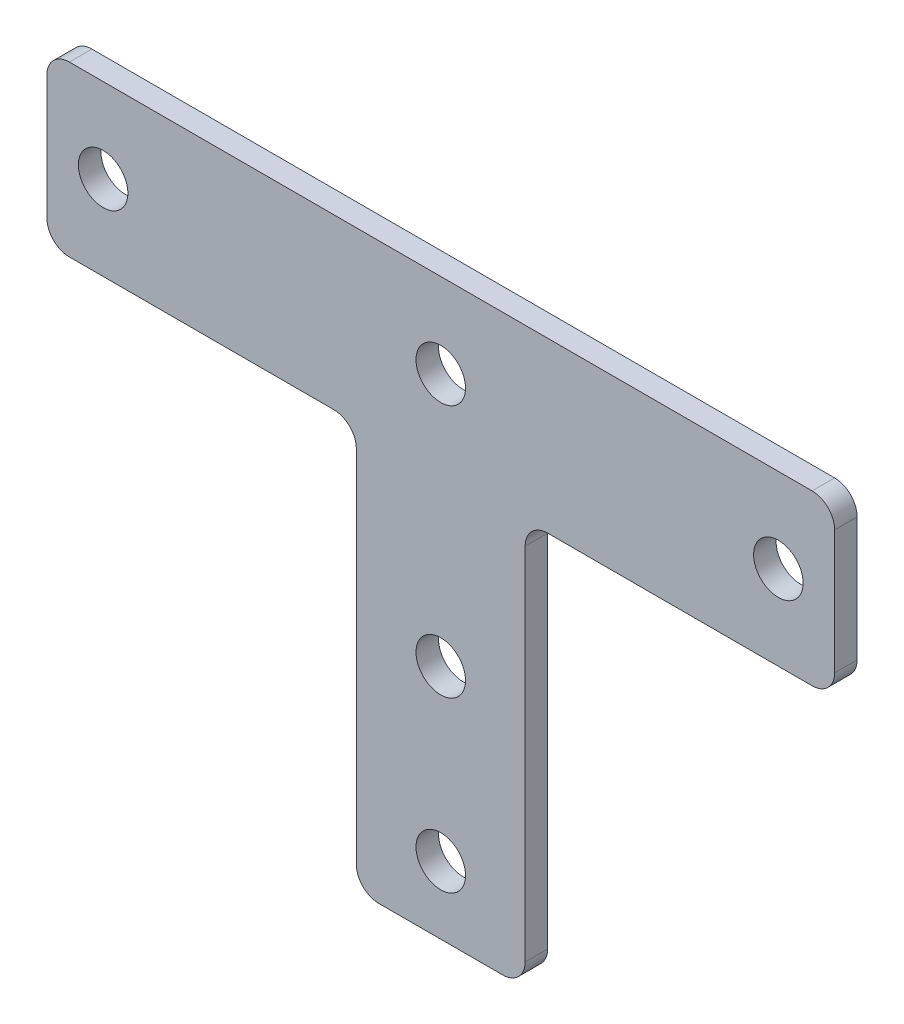
from build123d import *

# Parameters (mm, degrees)
SKETCH_1_W      = 27.5
SKETCH_1_H      = 15
SKETCH_1_R      = 2.2
SKETCH_1_W_2    = 15
SKETCH_1_H_2    = 36
EXTRUDE_1_DEPTH = 2
FILLET_1_R      = 2


with BuildPart() as part:
    # 草图1 → 凸台-拉伸1 (new body)
    # profile 1 of 4: a face of its own
    with BuildSketch(Plane.XY):
        with Locations((13.75, -7.5)):
            Rectangle(SKETCH_1_W, SKETCH_1_H)
        with Locations((5, -7.5)):
            Circle(SKETCH_1_R, mode=Mode.SUBTRACT)
    # profile 2 of 4: a face of its own
    with BuildSketch(Plane.XY):
        with Locations((56.25, -7.5)):
            Rectangle(SKETCH_1_W, SKETCH_1_H)
        with Locations((65, -7.5)):
            Circle(SKETCH_1_R, mode=Mode.SUBTRACT)
    # profile 3 of 4: a face of its own
    with BuildSketch(Plane.XY):
        with Locations((35, -7.5)):
            Rectangle(SKETCH_1_W_2, SKETCH_1_H)
        with Locations((35, -7.5)):
            Circle(SKETCH_1_R, mode=Mode.SUBTRACT)
    # profile 4 of 4: a face of its own
    with BuildSketch(Plane.XY):
        with Locations((35, -33)):
            Rectangle(SKETCH_1_W_2, SKETCH_1_H_2)
        with Locations((35, -45)):
            Circle(SKETCH_1_R, mode=Mode.SUBTRACT)
        with Locations((35, -30)):
            Circle(SKETCH_1_R, mode=Mode.SUBTRACT)
    extrude(amount=EXTRUDE_1_DEPTH)

    # 圆角1
    fillet_1_edges = [part.edges().sort_by_distance(p)[0] for p in [
        (0, -15, 1),
        (0, 0, 1),
        (70, 0, 1),
        (70, -15, 1),
        (42.5, -15, 1),
        (42.5, -51, 1),
        (27.5, -51, 1),
        (27.5, -15, 1),
    ]]
    fillet(fillet_1_edges, radius=FILLET_1_R)


solid = part.part
